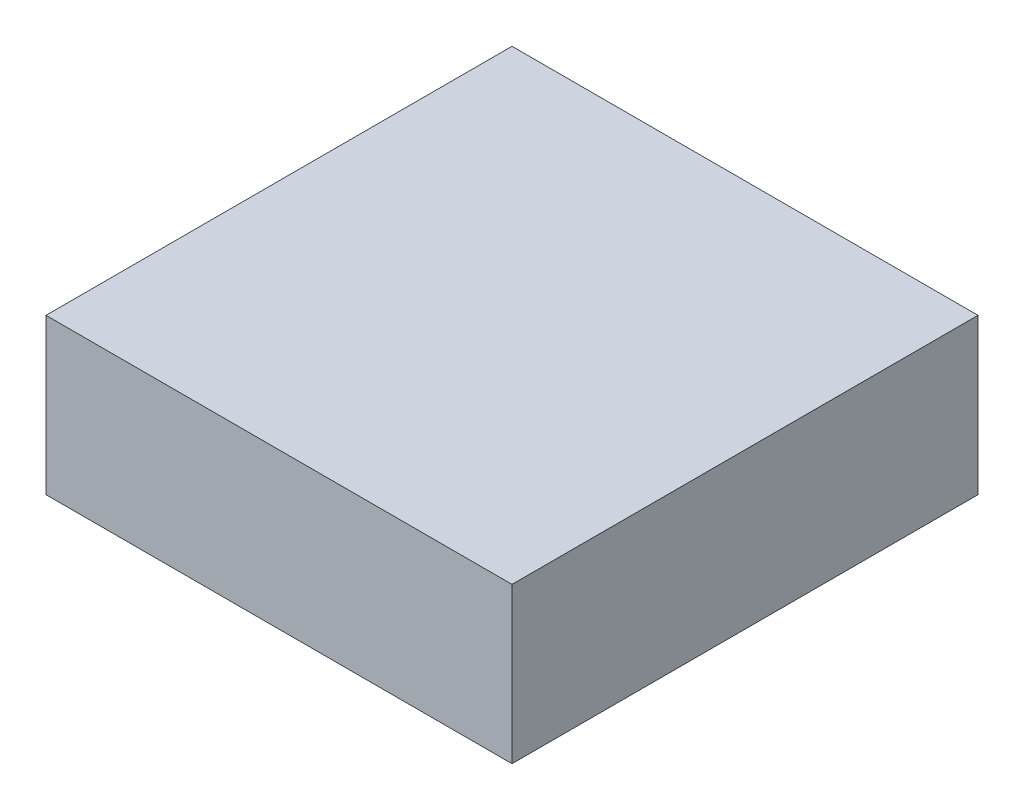
from build123d import *

# Parameters (mm, degrees)
SKETCH1_W           = 3
SKETCH1_H           = 3
BOSS_EXTRUDE1_DEPTH = 1


with BuildPart() as part:
    # Sketch1 → Boss-Extrude1 (new body)
    with BuildSketch(Plane(origin=(0, 0, 0), x_dir=(1, 0, 0), z_dir=(0, 1, 0))):
        with Locations((1.5, 1.5)):
            Rectangle(SKETCH1_W, SKETCH1_H)
    extrude(amount=BOSS_EXTRUDE1_DEPTH)


solid = part.part
